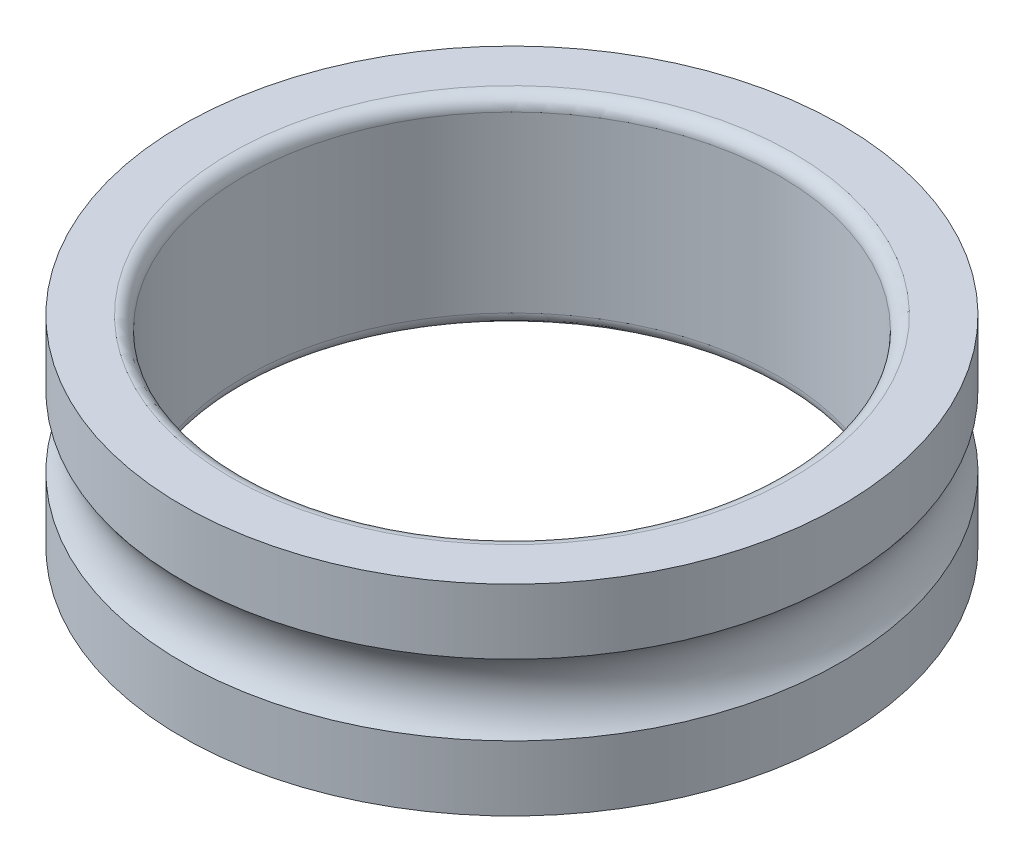
from build123d import *

# Parameters (mm, degrees)
FILLET1_R = 1


with BuildPart() as part:
    # Sketch1 → Revolve2 (revolve)
    with BuildSketch(Plane.XY, mode=Mode.PRIVATE) as revolve2_sk:
        with BuildLine():
            ThreePointArc((-23.61875, 7.5), (-23.878834577, 6.086926278), (-24.625, 4.859058821))
            Line((-24.625, 4.859058821), (-24.625, 0))
            Line((-24.625, 0), (-20, 0))
            Line((-20, 0), (-20, 15))
            Line((-20, 15), (-24.625, 15))
            Line((-24.625, 15), (-24.625, 10.140941179))
            ThreePointArc((-24.625, 10.140941179), (-23.878834577, 8.913073722), (-23.61875, 7.5))
        make_face()
    revolve(revolve2_sk.sketch.rotate(Axis((0, 0, 0), (0, 1, 0)), 270), axis=Axis((0, 0, 0), (0, 1, 0)))

    # Fillet1
    fillet1_edges = [part.edges().sort_by_distance(p)[0] for p in [
        (0, 15, 20),
        (0, 0, 20),
    ]]
    fillet(fillet1_edges, radius=FILLET1_R)


solid = part.part
